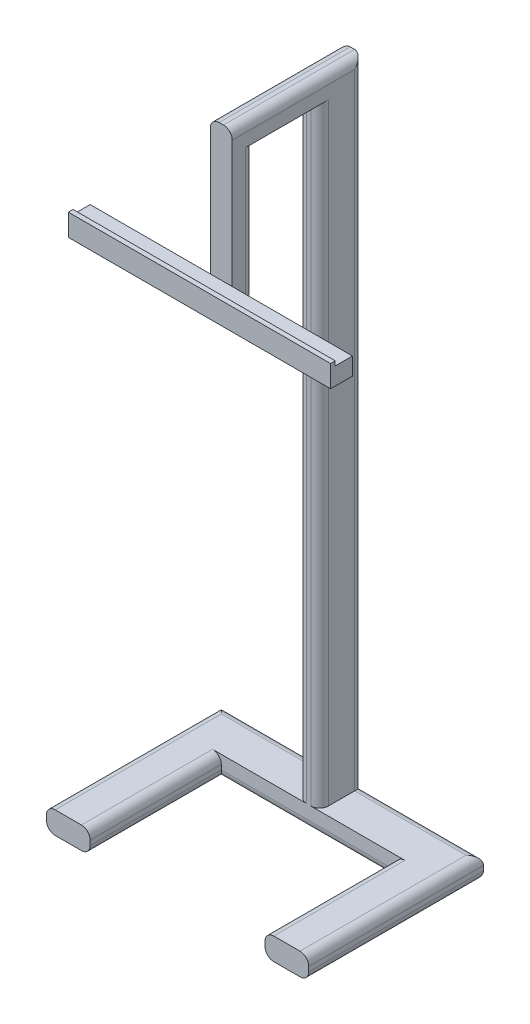
from build123d import *

# Parameters (mm, degrees)
SKETCH1_W           = 300
SKETCH1_H           = 200
BOSS_EXTRUDE1_DEPTH = 25.4
SKETCH2_W           = 200
SKETCH2_H           = 150
CUT_EXTRUDE1_DEPTH  = 25.4
SKETCH3_W           = 25
SKETCH3_H           = 50
BOSS_EXTRUDE2_DEPTH = 724.6
SKETCH5_W           = 25
SKETCH5_H           = 25
BOSS_EXTRUDE3_DEPTH = 100
SKETCH6_W           = 25
SKETCH6_H           = 25
BOSS_EXTRUDE4_DEPTH = 150
SKETCH7_W           = 300
SKETCH7_H           = 25
BOSS_EXTRUDE5_DEPTH = 25
SKETCH8_W           = 300
SKETCH8_H           = 19.64917274
CUT_EXTRUDE2_DEPTH  = 5
FILLET1_R           = 10


with BuildPart() as part:
    # Sketch1 → Boss-Extrude1 (new body)
    with BuildSketch(Plane(origin=(0, 0, 0), x_dir=(1, 0, 0), z_dir=(0, 1, 0))):
        Rectangle(SKETCH1_W, SKETCH1_H)
    extrude(amount=BOSS_EXTRUDE1_DEPTH)

    # Sketch2 → Cut-Extrude1 (cut)
    with BuildSketch(Plane(origin=(0, 25.4, 0), x_dir=(1, 0, 0), z_dir=(0, 1, 0))):
        with Locations((0, -25)):
            Rectangle(SKETCH2_W, SKETCH2_H)
    extrude(amount=-CUT_EXTRUDE1_DEPTH, mode=Mode.SUBTRACT)

    # Sketch3 → Boss-Extrude2 (add)
    with BuildSketch(Plane(origin=(0, 25.4, 0), x_dir=(1, 0, 0), z_dir=(0, 1, 0))):
        with Locations((0, 75)):
            Rectangle(SKETCH3_W, SKETCH3_H)
    extrude(amount=BOSS_EXTRUDE2_DEPTH)

    # Sketch5 → Boss-Extrude3 (add)
    with BuildSketch(Plane.XY.offset(-50)):
        with Locations((0, 737.5)):
            Rectangle(SKETCH5_W, SKETCH5_H)
    extrude(amount=BOSS_EXTRUDE3_DEPTH)

    # Sketch6 → Boss-Extrude4 (add)
    with BuildSketch(Plane.XZ.offset(-725)):
        with Locations((0, 37.5)):
            Rectangle(SKETCH6_W, SKETCH6_H)
    extrude(amount=BOSS_EXTRUDE4_DEPTH)

    # Sketch7 → Boss-Extrude5 (add)
    with BuildSketch(Plane.XY.offset(50)):
        with Locations((0, 587.5)):
            Rectangle(SKETCH7_W, SKETCH7_H)
    extrude(amount=BOSS_EXTRUDE5_DEPTH)

    # Sketch8 → Cut-Extrude2 (cut)
    with BuildSketch(Plane(origin=(0, 600, 0), x_dir=(1, 0, 0), z_dir=(0, 1, 0))):
        with Locations((0, -59.82458637)):
            Rectangle(SKETCH8_W, SKETCH8_H)
    extrude(amount=-CUT_EXTRUDE2_DEPTH, mode=Mode.SUBTRACT)

    # Fillet1
    fillet1_edges = [part.edges().sort_by_distance(p)[0] for p in [
        (-150, 25.4, 0),
        (-100, 0, 25),
        (0, 0, -50),
        (100, 0, 25),
        (-100, 25.4, 25),
        (100, 25.4, 25),
        (-81.25, 25.4, -100),
        (12.5, 387.7, -100),
        (-12.5, 387.7, -100),
        (12.5, 750, -25),
        (-12.5, 750, -25),
        (-12.5, 375.2, -50),
        (12.5, 375.2, -50),
        (150, 25.4, 0),
        (-150, 0, 0),
        (0, 0, -100),
        (-12.5, 650, 25),
        (12.5, 650, 25),
        (150, 0, 0),
        (81.25, 25.4, -100),
    ]]
    fillet(fillet1_edges, radius=FILLET1_R)


solid = part.part
